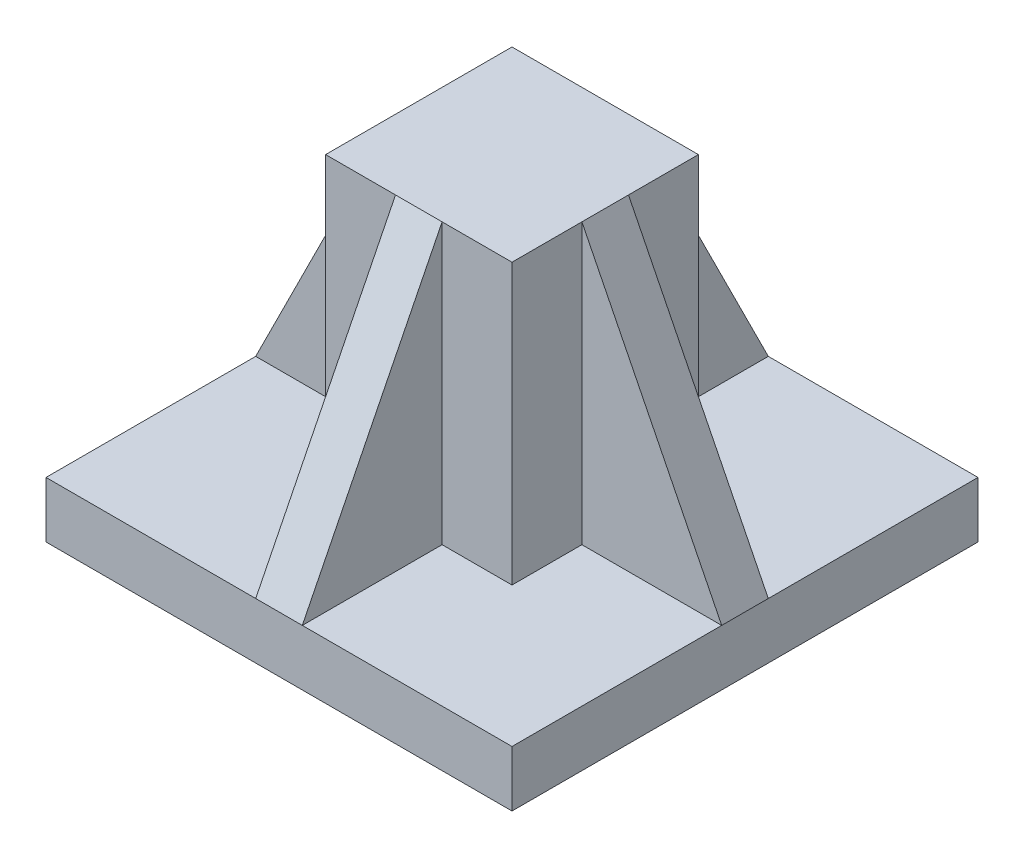
from build123d import *

# Parameters (mm, degrees)
SKETCH1_W           = 100
SKETCH1_H           = 100
BOSS_EXTRUDE1_DEPTH = 12
SKETCH2_W           = 100
SKETCH2_H           = 100
BOSS_EXTRUDE2_DEPTH = 60
SKETCH4_W           = 30
SKETCH4_H           = 60
CUT_EXTRUDE1_DEPTH  = 45
SKETCH5_W           = 30
SKETCH5_H           = 60
CUT_EXTRUDE2_DEPTH  = 45
SKETCH7_W           = 30
SKETCH7_H           = 60
CUT_EXTRUDE3_DEPTH  = 45
SKETCH8_W           = 30
SKETCH8_H           = 60
CUT_EXTRUDE4_DEPTH  = 15
SKETCH9_W           = 30
SKETCH9_H           = 60
CUT_EXTRUDE5_DEPTH  = 15
CUT_EXTRUDE6_DEPTH  = 104.484298326
CUT_EXTRUDE7_DEPTH  = 104.484298326


with BuildPart() as part:
    # Sketch1 → Boss-Extrude1 (new body)
    with BuildSketch(Plane(origin=(0, 0, 0), x_dir=(1, 0, 0), z_dir=(0, 1, 0))):
        Rectangle(SKETCH1_W, SKETCH1_H)
    extrude(amount=BOSS_EXTRUDE1_DEPTH)


with BuildPart() as body_2:
    # Sketch2 → Boss-Extrude2 (new body)
    with BuildSketch(Plane(origin=(0, 12, 0), x_dir=(1, 0, 0), z_dir=(0, 1, 0))):
        Rectangle(SKETCH2_W, SKETCH2_H)
    extrude(amount=BOSS_EXTRUDE2_DEPTH)

    # Sketch4 → Cut-Extrude1 (cut)
    with BuildSketch(Plane(origin=(50, 0, 0), x_dir=(0, 0, -1), z_dir=(1, 0, 0))):
        with Locations((-35, 42)):
            Rectangle(SKETCH4_W, SKETCH4_H)
    extrude(amount=-CUT_EXTRUDE1_DEPTH, mode=Mode.SUBTRACT)

    # Sketch5 → Cut-Extrude2 (cut)
    with BuildSketch(Plane(origin=(50, 0, 0), x_dir=(0, 0, -1), z_dir=(1, 0, 0))):
        with Locations((35, 42)):
            Rectangle(SKETCH5_W, SKETCH5_H)
    extrude(amount=-CUT_EXTRUDE2_DEPTH, mode=Mode.SUBTRACT)

    # Sketch7 → Cut-Extrude3 (cut)
    with BuildSketch(Plane.ZY.offset(50)):
        with Locations((-35, 42)):
            Rectangle(SKETCH7_W, SKETCH7_H)
        with Locations((35, 42)):
            Rectangle(SKETCH7_W, SKETCH7_H)
    extrude(amount=-CUT_EXTRUDE3_DEPTH, mode=Mode.SUBTRACT)

    # Sketch8 → Cut-Extrude4 (cut)
    with BuildSketch(Plane.XY.offset(20)):
        with Locations((35, 42)):
            Rectangle(SKETCH8_W, SKETCH8_H)
        with Locations((-35, 42)):
            Rectangle(SKETCH8_W, SKETCH8_H)
    extrude(amount=-CUT_EXTRUDE4_DEPTH, mode=Mode.SUBTRACT)

    # Sketch9 → Cut-Extrude5 (cut)
    with BuildSketch(Plane(origin=(0, 0, -20), x_dir=(-1, 0, 0), z_dir=(0, 0, -1))):
        with Locations((-35, 42)):
            Rectangle(SKETCH9_W, SKETCH9_H)
        with Locations((35, 42)):
            Rectangle(SKETCH9_W, SKETCH9_H)
    extrude(amount=-CUT_EXTRUDE5_DEPTH, mode=Mode.SUBTRACT)

    # Sketch10 → Cut-Extrude6 (cut, through all)
    with BuildSketch(Plane(origin=(5, 0, 0), x_dir=(0, 0, -1), z_dir=(1, 0, 0))):
        Polygon((-50, 12), (-50, 72), (-20, 72), align=None)
        Polygon((20, 72), (50, 12), (50, 72), align=None)
    extrude(amount=-CUT_EXTRUDE6_DEPTH, mode=Mode.SUBTRACT)

    # Sketch11 → Cut-Extrude7 (cut, through all)
    with BuildSketch(Plane.XY.offset(5)):
        Polygon((20, 72), (50, 72), (50, 12), align=None)
        Polygon((-20, 72), (-50, 72), (-50, 12), align=None)
    extrude(amount=-CUT_EXTRUDE7_DEPTH, mode=Mode.SUBTRACT)


solid = Compound([part.part, body_2.part])
